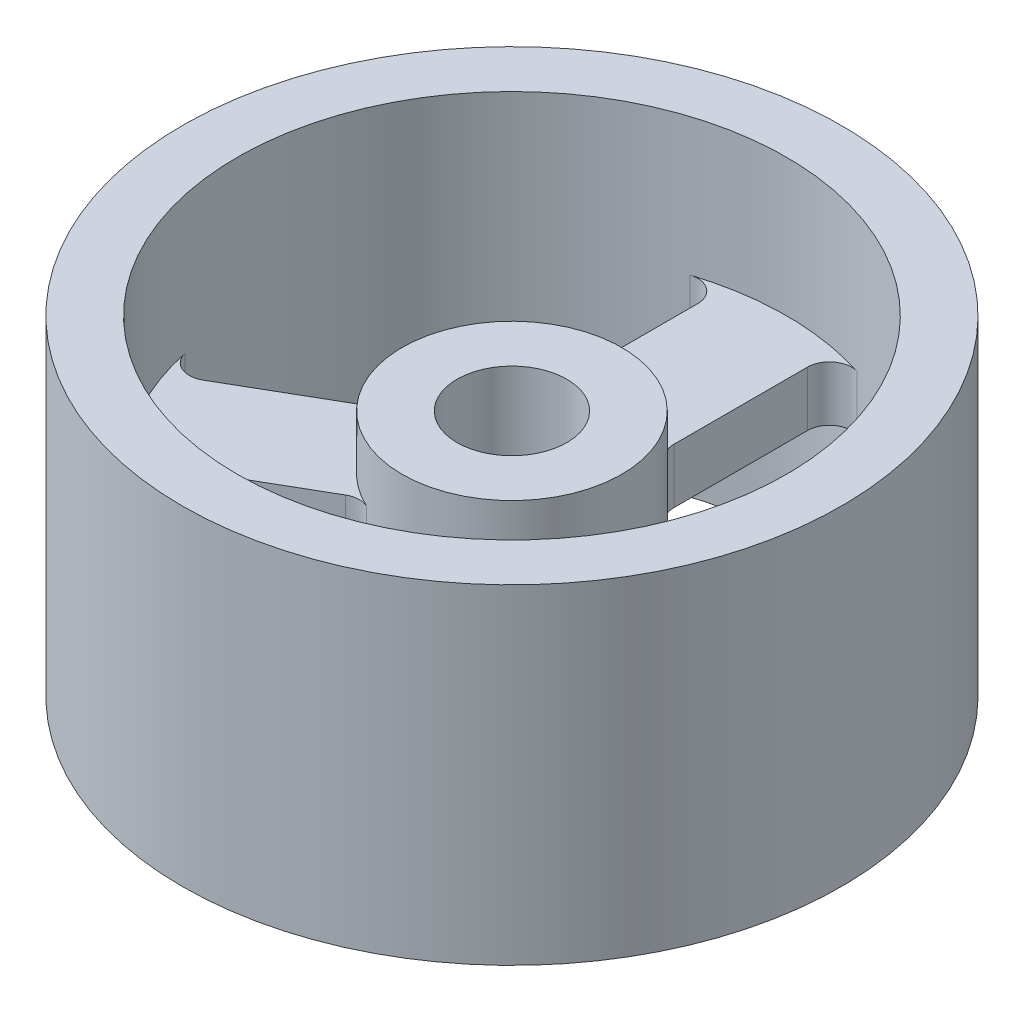
from build123d import *

# Parameters (mm, degrees)
SKETCH1_R           = 30
BOSS_EXTRUDE1_DEPTH = 15
SKETCH1_3_R         = 5
BOSS_EXTRUDE2_DEPTH = 7.5
BOSS_EXTRUDE3_DEPTH = 2.5


with BuildPart() as part:
    # Sketch1 → Boss-Extrude1 (new, symmetric)
    with BuildSketch(Plane(origin=(0, 0, 0), x_dir=(1, 0, 0), z_dir=(0, 1, 0))):
        Circle(SKETCH1_R)
        with BuildLine():
            ThreePointArc((25, 0), (24.856562962, -2.674187298), (24.427897784, -5.317688395))
            ThreePointArc((24.427897784, -5.317688395), (21.650635095, -12.5), (16.819202132, -18.496335844))
            ThreePointArc((16.819202132, -18.496335844), (0, -25), (-16.819202132, -18.496335844))
            ThreePointArc((-16.819202132, -18.496335844), (-21.650635095, -12.5), (-24.427897784, -5.317688395))
            ThreePointArc((-24.427897784, -5.317688395), (-21.650635095, 12.5), (-7.608695652, 23.814024239))
            ThreePointArc((-7.608695652, 23.814024239), (0, 25), (7.608695652, 23.814024239))
            ThreePointArc((7.608695652, 23.814024239), (20.189321327, 14.744195615), (25, 0))
        make_face(mode=Mode.SUBTRACT)
    extrude(amount=BOSS_EXTRUDE1_DEPTH, both=True)



with BuildPart() as body_2:
    # Sketch1<3> → Boss-Extrude2 (new, symmetric)
    with BuildSketch(Plane(origin=(0, 0, 0), x_dir=(1, 0, 0), z_dir=(0, 1, 0))):
        with BuildLine():
            ThreePointArc((10, 0), (9.987694827, 0.49593553), (9.95080959, 0.990650545))
            ThreePointArc((9.95080959, 0.990650545), (8.660254038, 5), (5.833333333, 8.122328621))
            ThreePointArc((5.833333333, 8.122328621), (0, 10), (-5.833333333, 8.122328621))
            ThreePointArc((-5.833333333, 8.122328621), (-8.660254038, 5), (-9.95080959, 0.990650545))
            ThreePointArc((-9.95080959, 0.990650545), (-8.660254038, -5), (-4.117476257, -9.112979166))
            ThreePointArc((-4.117476257, -9.112979166), (0, -10), (4.117476257, -9.112979166))
            ThreePointArc((4.117476257, -9.112979166), (8.40162968, -5.423340181), (10, 0))
        make_face()
        Circle(SKETCH1_3_R, mode=Mode.SUBTRACT)
    extrude(amount=BOSS_EXTRUDE2_DEPTH, both=True)


with BuildPart() as part_1:
    add(part.part)

    add(body_2.part)  # Boss-Extrude3 merges body 2
    # Sketch1<4> → Boss-Extrude3 (add, symmetric)
    with BuildSketch(Plane(origin=(0, 0, 0), x_dir=(1, 0, 0), z_dir=(0, 1, 0))):
        with BuildLine():
            Line((21.473665961, -6.624324131), (10.940971508, -0.543270153))
            ThreePointArc((10.940971508, -0.543270153), (10.260645572, 0.104112618), (9.95080959, 0.990650545))
            ThreePointArc((9.95080959, 0.990650545), (8.660254038, -5), (4.117476257, -9.112979166))
            ThreePointArc((4.117476257, -9.112979166), (5.040158614, -8.938036034), (5.940971508, -9.203524191))
            Line((5.940971508, -9.203524191), (16.473665961, -15.284578169))
            ThreePointArc((16.473665961, -15.284578169), (17.462190998, -16.802693993), (16.819202132, -18.496335844))
            ThreePointArc((16.819202132, -18.496335844), (21.650635095, -12.5), (24.427897784, -5.317688395))
            ThreePointArc((24.427897784, -5.317688395), (23.282655349, -6.721354014), (21.473665961, -6.624324131))
        make_face()
        with BuildLine():
            ThreePointArc((-5.833333333, 8.122328621), (0, 10), (5.833333333, 8.122328621))
            ThreePointArc((5.833333333, 8.122328621), (5.220486958, 8.833923416), (5, 9.746794345))
            Line((5, 9.746794345), (5, 21.9089023))
            ThreePointArc((5, 21.9089023), (5.820464351, 23.524048006), (7.608695652, 23.814024239))
            ThreePointArc((7.608695652, 23.814024239), (0, 25), (-7.608695652, 23.814024239))
            ThreePointArc((-7.608695652, 23.814024239), (-5.820464351, 23.524048006), (-5, 21.9089023))
            Line((-5, 21.9089023), (-5, 9.746794345))
            ThreePointArc((-5, 9.746794345), (-5.220486958, 8.833923416), (-5.833333333, 8.122328621))
        make_face()
        with BuildLine():
            ThreePointArc((-24.427897784, -5.317688395), (-21.650635095, -12.5), (-16.819202132, -18.496335844))
            ThreePointArc((-16.819202132, -18.496335844), (-17.462190998, -16.802693993), (-16.473665961, -15.284578169))
            Line((-16.473665961, -15.284578169), (-5.940971508, -9.203524191))
            ThreePointArc((-5.940971508, -9.203524191), (-5.040158614, -8.938036034), (-4.117476257, -9.112979166))
            ThreePointArc((-4.117476257, -9.112979166), (-8.660254038, -5), (-9.95080959, 0.990650545))
            ThreePointArc((-9.95080959, 0.990650545), (-10.260645572, 0.104112618), (-10.940971508, -0.543270153))
            Line((-10.940971508, -0.543270153), (-21.473665961, -6.624324131))
            ThreePointArc((-21.473665961, -6.624324131), (-23.282655349, -6.721354014), (-24.427897784, -5.317688395))
        make_face()
    extrude(amount=BOSS_EXTRUDE3_DEPTH, both=True)


solid = part_1.part
